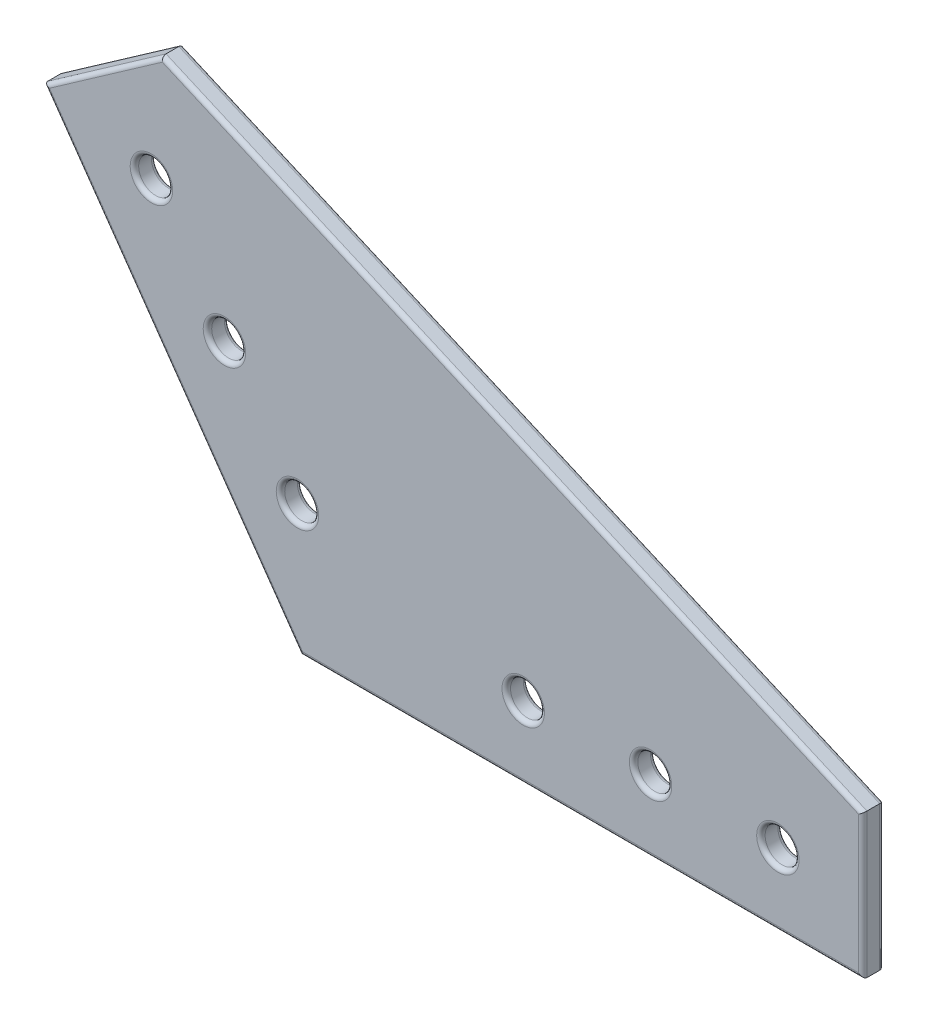
from build123d import *

# Parameters (mm, degrees)
BOSS_EXTRUDE1_DEPTH = 5
SKETCH2_R           = 4
CUT_EXTRUDE1_DEPTH  = 156.273789463
FILLET2_R           = 1


with BuildPart() as part:
    # Sketch1 → Boss-Extrude1 (new body)
    with BuildSketch(Plane.XY):
        Polygon((-141.462981861, 22.599114355), (-113.611812355, 42.100713191), (51.549332174, -29.821426317), (51.549332174, -63.821426317), (-80.950667826, -63.821426317), align=None)
    extrude(amount=BOSS_EXTRUDE1_DEPTH)

    # Sketch2 → Cut-Extrude1 (cut, through all)
    with BuildSketch(Plane.XY.offset(5)):
        with Locations((-116.065868381, 15.966872887)):
            Circle(SKETCH2_R)
        with Locations((31.549332174, -46.821426317)):
            Circle(SKETCH2_R)
        with Locations((-98.85857529, -8.607688441)):
            Circle(SKETCH2_R)
        with Locations((-81.6512822, -33.18224977)):
            Circle(SKETCH2_R)
        with Locations((1.549332174, -46.821426317)):
            Circle(SKETCH2_R)
        with Locations((-28.450667826, -46.821426317)):
            Circle(SKETCH2_R)
    extrude(amount=-CUT_EXTRUDE1_DEPTH, mode=Mode.SUBTRACT)

    # Fillet2
    fillet2_edges = [part.edges().sort_by_distance(p)[0] for p in [
        (51.549332174, -46.821426317, 5),
        (-31.03124009, 6.139643437, 5),
        (-127.537397108, 32.349913773, 5),
        (27.549332174, -46.821426317, 0),
        (27.549332174, -46.821426317, 5),
        (-32.450667826, -46.821426317, 0),
        (-32.450667826, -46.821426317, 5),
        (-120.065868381, 15.966872887, 0),
        (-120.065868381, 15.966872887, 5),
        (-102.85857529, -8.607688441, 0),
        (-102.85857529, -8.607688441, 5),
        (-85.6512822, -33.18224977, 0),
        (-85.6512822, -33.18224977, 5),
        (-2.450667826, -46.821426317, 0),
        (-2.450667826, -46.821426317, 5),
        (-111.206824843, -20.611155981, 5),
        (-127.537397108, 32.349913773, 0),
        (-31.03124009, 6.139643437, 0),
        (51.549332174, -46.821426317, 0),
        (-14.700667826, -63.821426317, 0),
        (-111.206824843, -20.611155981, 0),
        (-14.700667826, -63.821426317, 5),
    ]]
    fillet(fillet2_edges, radius=FILLET2_R)


solid = part.part
